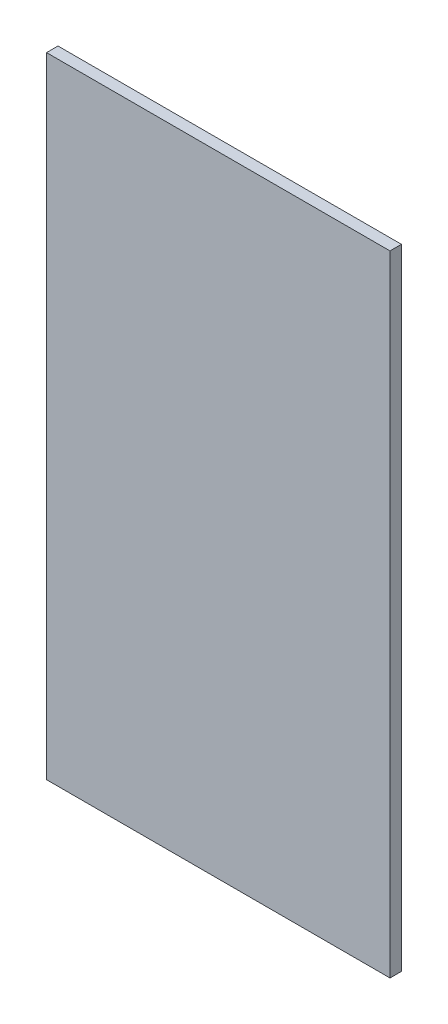
from build123d import *

# Parameters (mm, degrees)
CROQUIS2_W              = 300
CROQUIS2_H              = 550
SALIENTE_EXTRUIR1_DEPTH = 10


with BuildPart() as part:
    # Croquis2 → Saliente-Extruir1 (new body)
    with BuildSketch(Plane.XY):
        with Locations((150, 275)):
            Rectangle(CROQUIS2_W, CROQUIS2_H)
    extrude(amount=SALIENTE_EXTRUIR1_DEPTH)


solid = part.part
